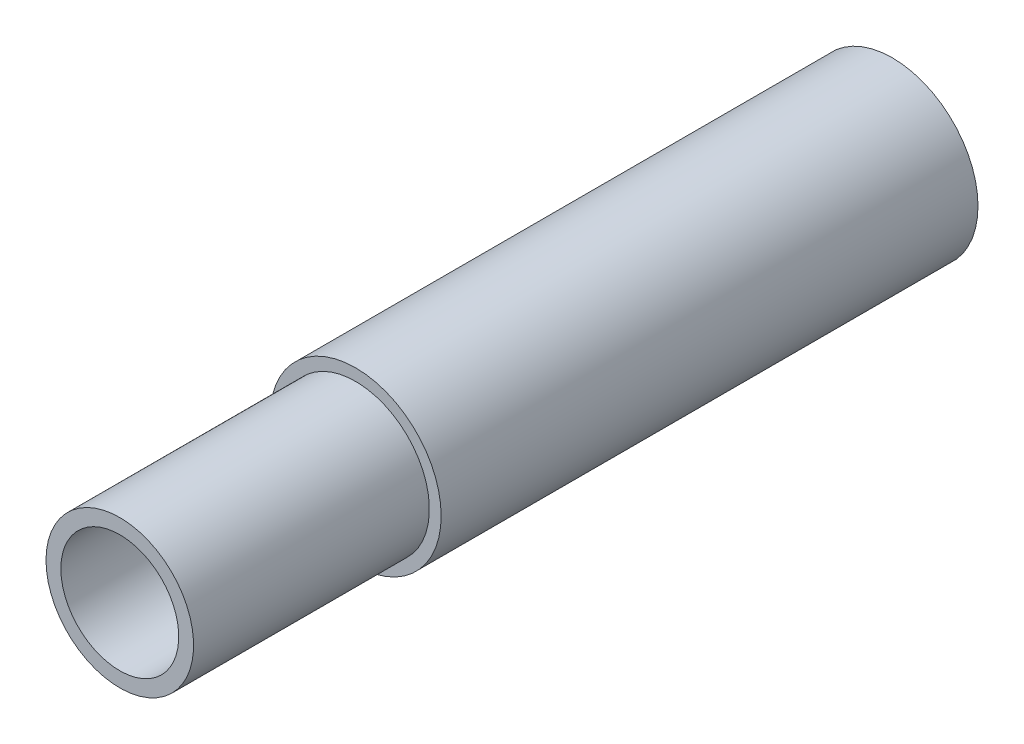
from build123d import *

# Parameters (mm, degrees)
SWEEP1_PROFILE_R     = 9.9375
CUT_SWEEP1_PROFILE_R = 7.9375
SWEEP2_PROFILE_R     = 11.525
CUT_SWEEP2_PROFILE_R = 9.525


with BuildPart() as part:
    # Sweep1: sweep along a path in Sketch9
    with BuildLine(Plane(origin=(0, 0, 0), x_dir=(1, 0, 0), z_dir=(0, 1, 0))) as sweep1_path:
        Line((0, 0), (0, 31.75))
    # Sweep1 profile (on start of the path) → Sweep1 (sweep)
    with BuildSketch(Plane(origin=(0, 0, 0), x_dir=(-1, 0, 0), z_dir=(0, 0, -1))):
        Circle(SWEEP1_PROFILE_R)
    sweep(path=sweep1_path.line)

    # Cut-Sweep1: sweep along a path in Sketch9<2>
    with BuildLine(Plane(origin=(0, 0, 0), x_dir=(1, 0, 0), z_dir=(0, 1, 0))) as cut_sweep1_path:
        Line((0, 0), (0, 31.75))
    # Cut-Sweep1 profile (on start of the path) → Cut-Sweep1 (sweep, cut)
    with BuildSketch(Plane(origin=(0, 0, 0), x_dir=(-1, 0, 0), z_dir=(0, 0, -1))):
        Circle(CUT_SWEEP1_PROFILE_R)
    sweep(path=cut_sweep1_path.line, mode=Mode.SUBTRACT)

    # Sweep2: sweep along a path in Sketch31
    with BuildLine(Plane(origin=(0, 0, 0), x_dir=(1, 0, 0), z_dir=(0, 1, 0))) as sweep2_path:
        Line((0, 31.75), (0, 104.0384))
    # Sweep2 profile (on start of the path) → Sweep2 (sweep)
    with BuildSketch(Plane(origin=(0, 0, -31.75), x_dir=(-1, 0, 0), z_dir=(0, 0, -1))):
        Circle(SWEEP2_PROFILE_R)
    sweep(path=sweep2_path.line)

    # Cut-Sweep2: sweep along a path in Sketch31<2>
    with BuildLine(Plane(origin=(0, 0, 0), x_dir=(1, 0, 0), z_dir=(0, 1, 0))) as cut_sweep2_path:
        Line((0, 31.75), (0, 104.0384))
    # Cut-Sweep2 profile (on start of the path) → Cut-Sweep2 (sweep, cut)
    with BuildSketch(Plane(origin=(0, 0, -31.75), x_dir=(-1, 0, 0), z_dir=(0, 0, -1))):
        Circle(CUT_SWEEP2_PROFILE_R)
    sweep(path=cut_sweep2_path.line, mode=Mode.SUBTRACT)


solid = part.part
